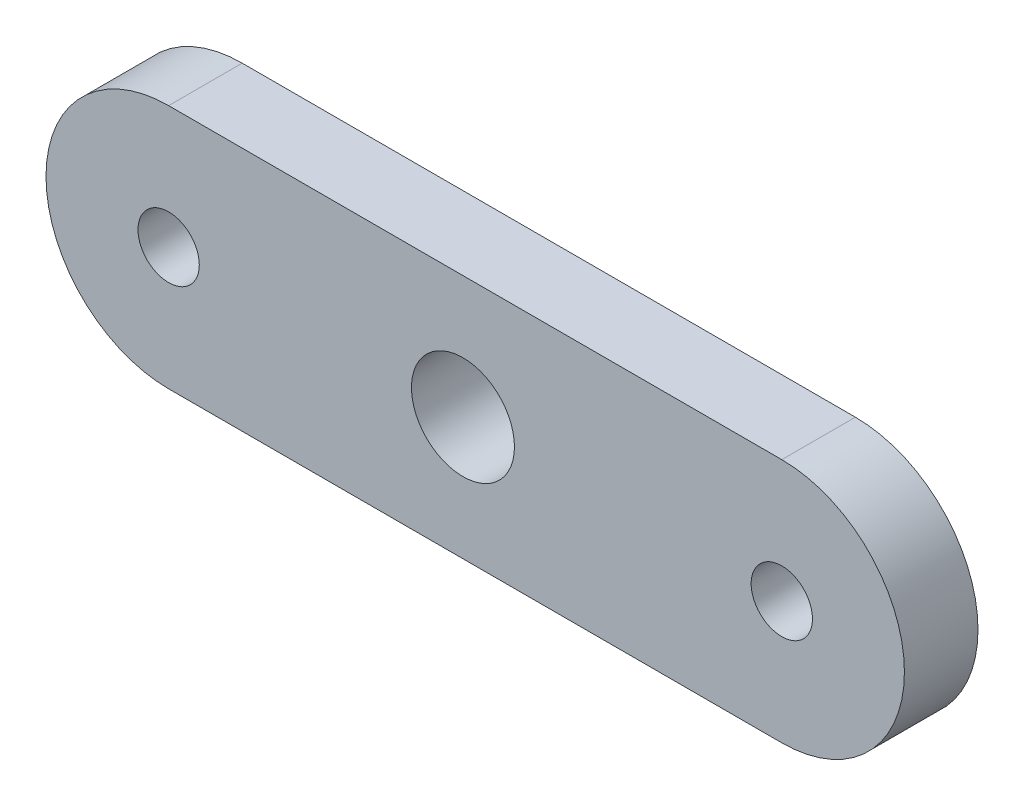
from build123d import *
from build123d.topology import SkipClean

# Parameters (mm, degrees)
SKETCH1_R           = 1.5
SKETCH1_R_2         = 1.25
BOSS_EXTRUDE1_DEPTH = 3
SKETCH5_R           = 2.1
CUT_EXTRUDE2_DEPTH  = 10
BOSS_EXTRUDE2_DEPTH = 3


with BuildPart() as part:
    # Sketch1 → Boss-Extrude1 (new body)
    with BuildSketch(Plane.XY):
        with BuildLine():
            Line((-78.015219505, 31.020337279), (-53.015219505, 31.020337279))
            ThreePointArc((-53.015219505, 31.020337279), (-48.015219505, 26.020337279), (-53.015219505, 21.020337279))
            Line((-53.015219505, 21.020337279), (-78.015219505, 21.020337279))
            ThreePointArc((-78.015219505, 21.020337279), (-83.015219505, 26.020337279), (-78.015219505, 31.020337279))
        make_face()
        with Locations((-63.015219505, 26.020337279)):
            Circle(SKETCH1_R, mode=Mode.SUBTRACT)
        with Locations((-53.015219505, 26.020337279)):
            Circle(SKETCH1_R_2, mode=Mode.SUBTRACT)
        with Locations((-78.015219505, 26.020337279)):
            Circle(SKETCH1_R_2, mode=Mode.SUBTRACT)
    extrude(amount=BOSS_EXTRUDE1_DEPTH)

    # Sketch5 → Cut-Extrude2 (cut)
    with BuildSketch(Plane.XY.offset(3)):
        with Locations((-66.015219505, 26.020337279)):
            Circle(SKETCH5_R)
    extrude(amount=-CUT_EXTRUDE2_DEPTH, mode=Mode.SUBTRACT)

    # Sketch6 → Boss-Extrude2 (add)
    with SkipClean():  # the faces are left unmerged after this step: merging them gives an invalid solid
        with BuildSketch(Plane.XY.offset(3)):
            with BuildLine():
                ThreePointArc((-64.155219505, 25.045452671), (-61.515219505, 26.020337279), (-64.155219505, 26.995221888))
                ThreePointArc((-64.155219505, 26.995221888), (-63.915219505, 26.020337279), (-64.155219505, 25.045452671))
            make_face()
        extrude(amount=-BOSS_EXTRUDE2_DEPTH)


solid = part.part
